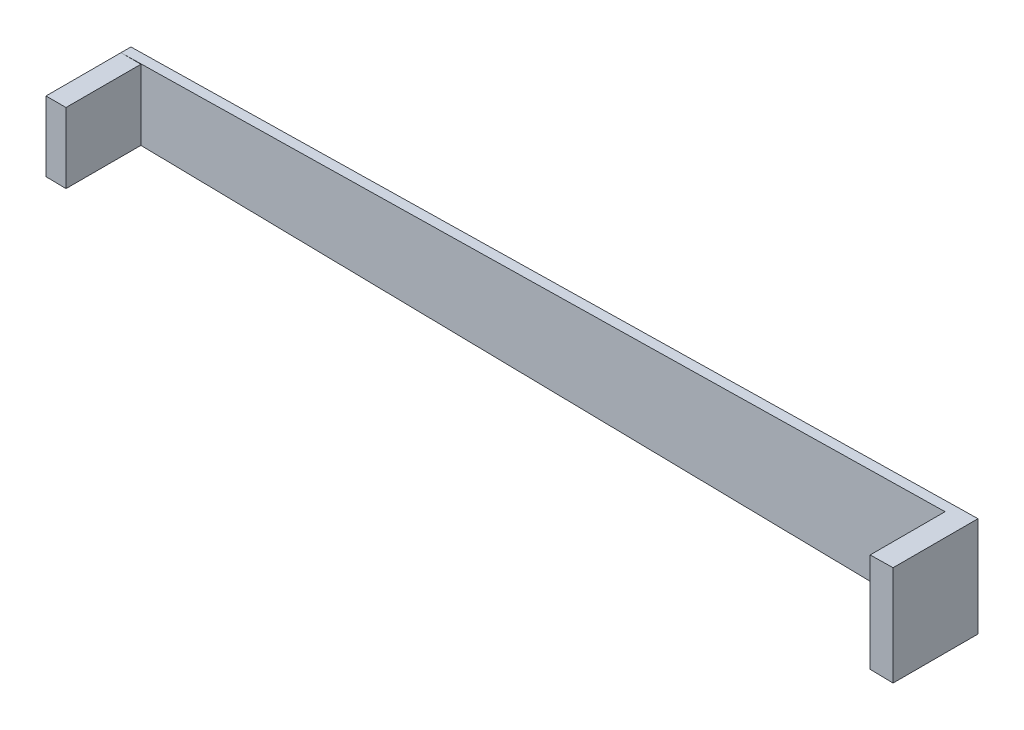
from build123d import *

# Parameters (mm, degrees)
EXTRUDE_1_DEPTH = 2
EXTRUDE_2_DEPTH = 15


with BuildPart() as part:
    # 스케치1 → 보스-돌출1 (new body)
    with BuildSketch(Plane.XY):
        Polygon((-69.825, -7), (99.75, -10), (99.75, 10), (-69.825, 7), align=None)
    extrude(amount=EXTRUDE_1_DEPTH)

    # 스케치2 → 보스-돌출2 (add)
    with BuildSketch(Plane.XY.offset(2)):
        Polygon((-65.825, 7), (-69.825, 7), (-69.825, -7), (-65.825, -7.070765148), align=None)
        Polygon((99.75, 10), (95.16, 9.918796992), (95.16, -9.918796992), (99.75, -9.918796992), align=None)
        Polygon((99.75, -9.918796992), (95.16, -9.918796992), (99.75, -10), align=None)
    extrude(amount=EXTRUDE_2_DEPTH)


solid = part.part
